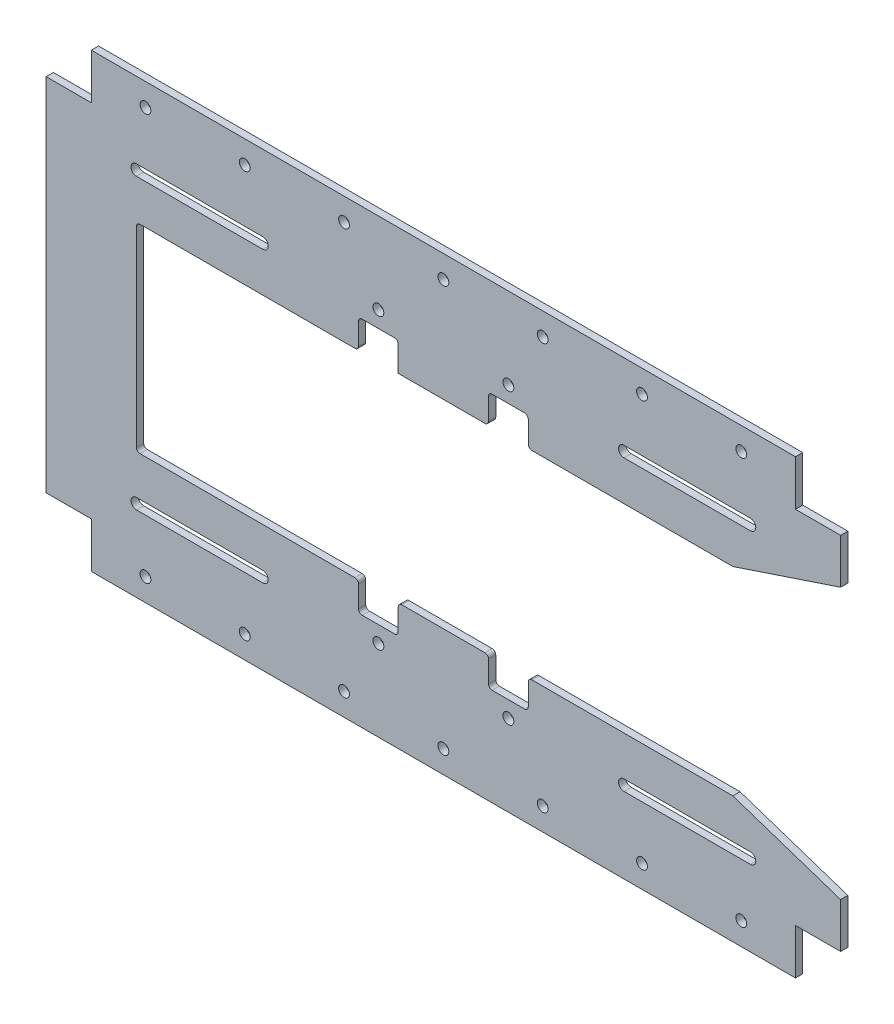
from build123d import *

# Parameters (mm, degrees)
MODEL_R             = 3
BOSS_EXTRUDE1_DEPTH = 4


with BuildPart() as part:
    # Model → Boss-Extrude1 (new body)
    with BuildSketch(Plane.XY):
        with BuildLine():
            Line((220, -99.8), (220, -74.9))
            Line((220, -74.9), (160.3, -55))
            Line((160.3, -55), (49, -55))
            ThreePointArc((49, -55), (47.585786438, -55.585786438), (47, -57))
            Line((47, -57), (47, -69))
            ThreePointArc((47, -69), (46.414213562, -70.414213562), (45, -71))
            Line((45, -71), (27, -71))
            ThreePointArc((27, -71), (25.585786438, -70.414213562), (25, -69))
            Line((25, -69), (25, -57))
            ThreePointArc((25, -57), (24.414213562, -55.585786438), (23, -55))
            Line((23, -55), (-23, -55))
            ThreePointArc((-23, -55), (-24.414213562, -55.585786438), (-25, -57))
            Line((-25, -57), (-25, -69))
            ThreePointArc((-25, -69), (-25.585786438, -70.414213562), (-27, -71))
            Line((-27, -71), (-45, -71))
            ThreePointArc((-45, -71), (-46.414213562, -70.414213562), (-47, -69))
            Line((-47, -69), (-47, -57))
            ThreePointArc((-47, -57), (-47.585786438, -55.585786438), (-49, -55))
            Line((-49, -55), (-168, -55))
            ThreePointArc((-168, -55), (-169.414213562, -54.414213562), (-170, -53))
            Line((-170, -53), (-170, 53))
            ThreePointArc((-170, 53), (-169.414213562, 54.414213562), (-168, 55))
            Line((-168, 55), (-49, 55))
            ThreePointArc((-49, 55), (-47.585786438, 55.585786438), (-47, 57))
            Line((-47, 57), (-47, 69))
            ThreePointArc((-47, 69), (-46.414213562, 70.414213562), (-45, 71))
            Line((-45, 71), (-27, 71))
            ThreePointArc((-27, 71), (-25.585786438, 70.414213562), (-25, 69))
            Line((-25, 69), (-25, 55))
            Line((-25, 55), (23, 55))
            ThreePointArc((23, 55), (24.414213562, 55.585786438), (25, 57))
            Line((25, 57), (25, 69))
            ThreePointArc((25, 69), (25.585786438, 70.414213562), (27, 71))
            Line((27, 71), (45, 71))
            ThreePointArc((45, 71), (46.414213562, 70.414213562), (47, 69))
            Line((47, 69), (47, 57))
            ThreePointArc((47, 57), (47.585786438, 55.585786438), (49, 55))
            Line((49, 55), (160.3, 55))
            Line((160.3, 55), (220, 74.9))
            Line((220, 74.9), (220, 99.8))
            Line((220, 99.8), (195, 99.8))
            Line((195, 99.8), (195, 125))
            Line((195, 125), (-195, 125))
            Line((-195, 125), (-195, 99.8))
            Line((-195, 99.8), (-220, 99.8))
            Line((-220, 99.8), (-220, -99.8))
            Line((-220, -99.8), (-195, -99.8))
            Line((-195, -99.8), (-195, -125))
            Line((-195, -125), (195, -125))
            Line((195, -125), (195, -99.8))
            Line((195, -99.8), (220, -99.8))
        make_face()
        with Locations((36, 80)):
            Circle(MODEL_R, mode=Mode.SUBTRACT)
        with Locations((-36, -80)):
            Circle(MODEL_R, mode=Mode.SUBTRACT)
        with Locations((-36, 80)):
            Circle(MODEL_R, mode=Mode.SUBTRACT)
        with Locations((36, -80)):
            Circle(MODEL_R, mode=Mode.SUBTRACT)
        with Locations((55, 112.5)):
            Circle(MODEL_R, mode=Mode.SUBTRACT)
        with Locations((-110, 112.5)):
            Circle(MODEL_R, mode=Mode.SUBTRACT)
        with Locations((-55, 112.5)):
            Circle(MODEL_R, mode=Mode.SUBTRACT)
        with Locations((0, 112.5)):
            Circle(MODEL_R, mode=Mode.SUBTRACT)
        with Locations((-165, 112.5)):
            Circle(MODEL_R, mode=Mode.SUBTRACT)
        with Locations((110, 112.5)):
            Circle(MODEL_R, mode=Mode.SUBTRACT)
        with Locations((165, 112.5)):
            Circle(MODEL_R, mode=Mode.SUBTRACT)
        with Locations((110, -112.5)):
            Circle(MODEL_R, mode=Mode.SUBTRACT)
        with Locations((-165, -112.5)):
            Circle(MODEL_R, mode=Mode.SUBTRACT)
        with Locations((0, -112.5)):
            Circle(MODEL_R, mode=Mode.SUBTRACT)
        with Locations((-55, -112.5)):
            Circle(MODEL_R, mode=Mode.SUBTRACT)
        with Locations((-110, -112.5)):
            Circle(MODEL_R, mode=Mode.SUBTRACT)
        with Locations((55, -112.5)):
            Circle(MODEL_R, mode=Mode.SUBTRACT)
        with Locations((165, -112.5)):
            Circle(MODEL_R, mode=Mode.SUBTRACT)
        with BuildLine():
            Line((170, -83), (100, -83))
            ThreePointArc((100, -83), (97, -80), (100, -77))
            Line((100, -77), (170, -77))
            ThreePointArc((170, -77), (173, -80), (170, -83))
        make_face(mode=Mode.SUBTRACT)
        with BuildLine():
            Line((-170, -77), (-100, -77))
            ThreePointArc((-100, -77), (-97, -80), (-100, -83))
            Line((-100, -83), (-170, -83))
            ThreePointArc((-170, -83), (-173, -80), (-170, -77))
        make_face(mode=Mode.SUBTRACT)
        with BuildLine():
            Line((170, 77), (100, 77))
            ThreePointArc((100, 77), (97, 80), (100, 83))
            Line((100, 83), (170, 83))
            ThreePointArc((170, 83), (173, 80), (170, 77))
        make_face(mode=Mode.SUBTRACT)
        with BuildLine():
            Line((-170, 83), (-100, 83))
            ThreePointArc((-100, 83), (-97, 80), (-100, 77))
            Line((-100, 77), (-170, 77))
            ThreePointArc((-170, 77), (-173, 80), (-170, 83))
        make_face(mode=Mode.SUBTRACT)
    extrude(amount=BOSS_EXTRUDE1_DEPTH)


solid = part.part
